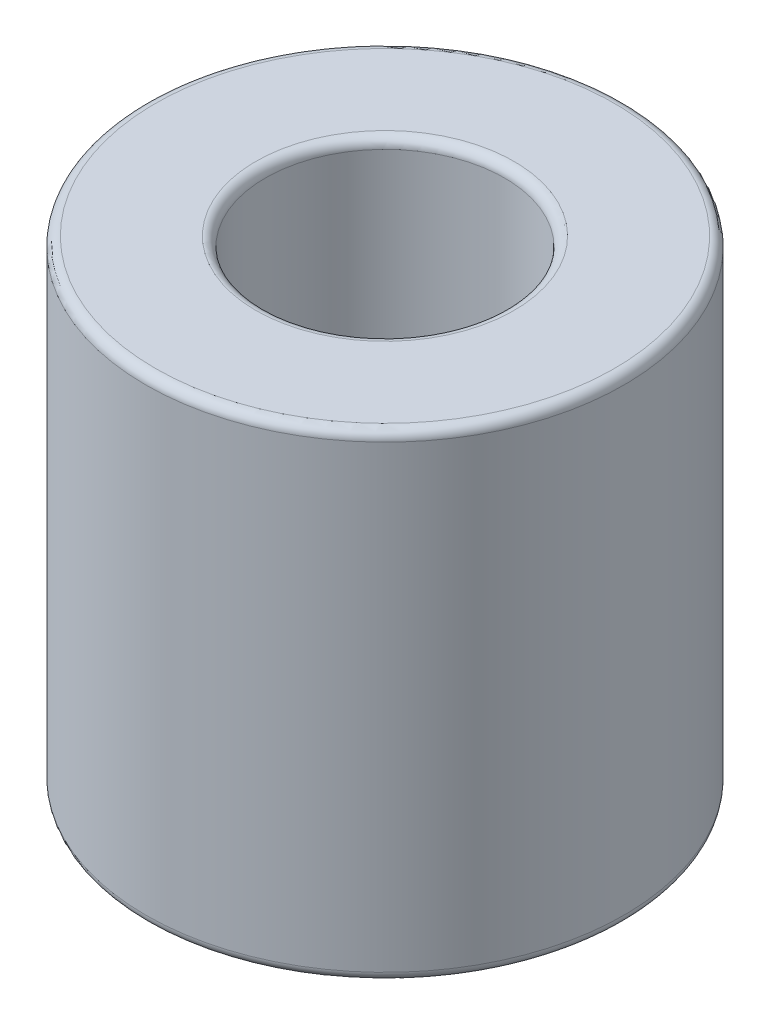
from build123d import *

# Parameters (mm, degrees)
SKETCH1_R           = 3.175
BOSS_EXTRUDE1_DEPTH = 6.35
SKETCH2_R           = 1.5875
CUT_EXTRUDE1_DEPTH  = 8.777129933
FILLET1_R           = 0.127


with BuildPart() as part:
    # Sketch1 → Boss-Extrude1 (new body)
    with BuildSketch(Plane(origin=(0, 0, 0), x_dir=(1, 0, 0), z_dir=(0, 1, 0))):
        with Locations(Location((0, 0, 0), (0, 0, 270))):
            Circle(SKETCH1_R)
    extrude(amount=BOSS_EXTRUDE1_DEPTH)

    # Sketch2 → Cut-Extrude1 (cut, through all)
    with BuildSketch(Plane(origin=(0, 6.35, 0), x_dir=(1, 0, 0), z_dir=(0, 1, 0))):
        with Locations(Location((0, 0, 0), (0, 0, 270))):
            Circle(SKETCH2_R)
    extrude(amount=-CUT_EXTRUDE1_DEPTH, mode=Mode.SUBTRACT)

    # Fillet1
    fillet1_edges = [part.edges().sort_by_distance(p)[0] for p in [
        (0, 0, -3.175),
        (0, 6.35, -3.175),
        (0, 0, -1.5875),
        (0, 6.35, -1.5875),
    ]]
    fillet(fillet1_edges, radius=FILLET1_R)


solid = part.part
